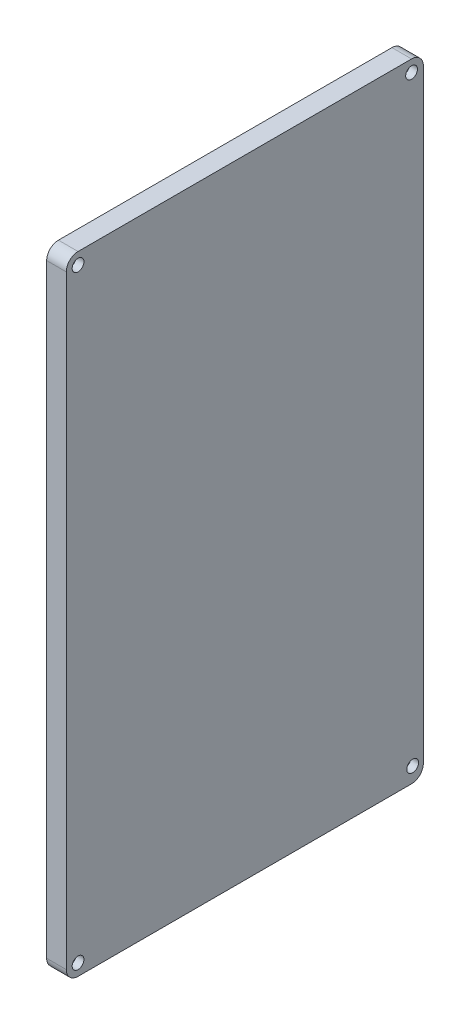
from build123d import *

# Parameters (mm, degrees)
SKETCH1_W           = 91
SKETCH1_H           = 160
BOSS_EXTRUDE1_DEPTH = 5
FILLET1_R           = 3
SKETCH2_R           = 2.5
CUT_EXTRUDE1_DEPTH  = 3
SKETCH3_R           = 1.5
CUT_EXTRUDE2_DEPTH  = 5


with BuildPart() as part:
    # Sketch1 → Boss-Extrude1 (new body)
    with BuildSketch(Plane(origin=(0, 0, 0), x_dir=(0, 0, -1), z_dir=(1, 0, 0))):
        Rectangle(SKETCH1_W, SKETCH1_H)
    extrude(amount=-BOSS_EXTRUDE1_DEPTH)

    # Fillet1
    fillet1_edges = [part.edges().sort_by_distance(p)[0] for p in [
        (-2.5, -80, -45.5),
        (-2.5, -80, 45.5),
        (-2.5, 80, 45.5),
        (-2.5, 80, -45.5),
    ]]
    fillet(fillet1_edges, radius=FILLET1_R)

    # Sketch2 → Cut-Extrude1 (cut)
    with BuildSketch(Plane.ZY.offset(5)):
        with Locations((-42.774595658, -76.1955969)):
            Circle(SKETCH2_R)
        with Locations((42.5, -77)):
            Circle(SKETCH2_R)
        with Locations((42.5, 77)):
            Circle(SKETCH2_R)
        with Locations((-42.5, 77)):
            Circle(SKETCH2_R)
    extrude(amount=-CUT_EXTRUDE1_DEPTH, mode=Mode.SUBTRACT)

    # Sketch3 → Cut-Extrude2 (cut)
    with BuildSketch(Plane.ZY.offset(2)):
        with Locations((-42.5, 77)):
            Circle(SKETCH3_R)
        with Locations((42.5, 77)):
            Circle(SKETCH3_R)
        with Locations((42.5, -77)):
            Circle(SKETCH3_R)
        with Locations((-42.774595658, -76.1955969)):
            Circle(SKETCH3_R)
    extrude(amount=-CUT_EXTRUDE2_DEPTH, mode=Mode.SUBTRACT)


solid = part.part
